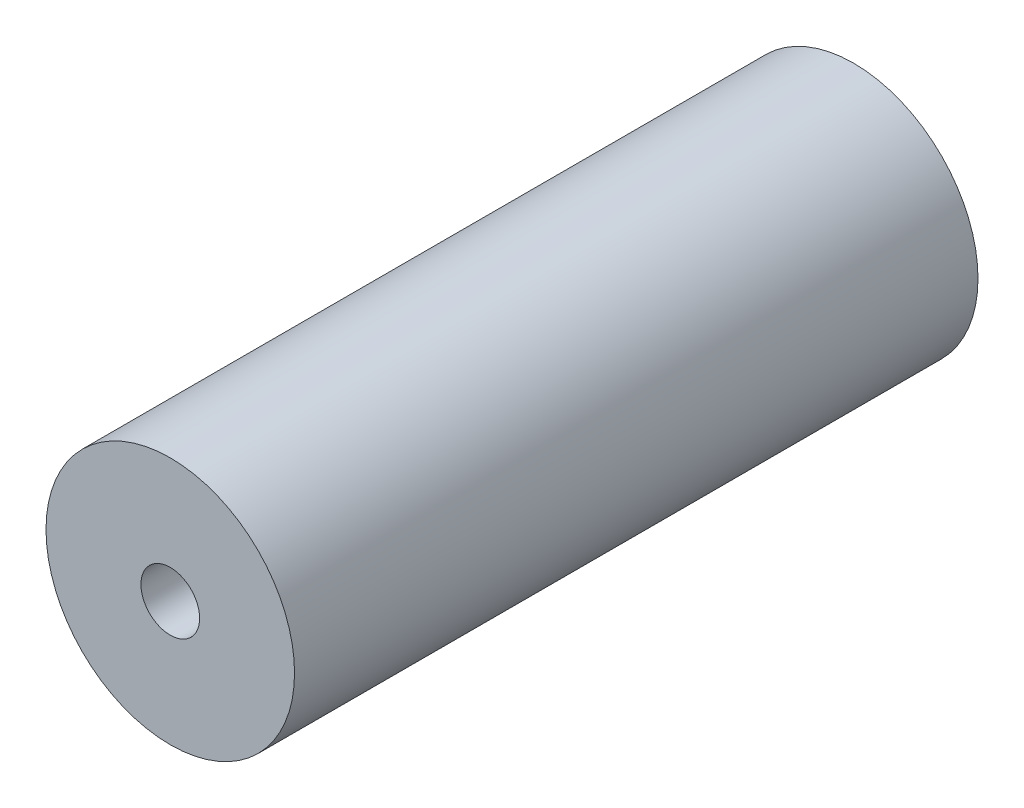
from build123d import *

# Parameters (mm, degrees)
SKETCH1_R           = 12.7
BOSS_EXTRUDE1_DEPTH = 69.85
SKETCH2_R           = 3
CUT_EXTRUDE3_DEPTH  = 69.85


with BuildPart() as part:
    # Sketch1 → Boss-Extrude1 (new body)
    with BuildSketch(Plane.XY):
        Circle(SKETCH1_R)
    extrude(amount=BOSS_EXTRUDE1_DEPTH)

    # Sketch2 → Cut-Extrude3 (cut)
    with BuildSketch(Plane.XY.offset(69.85)):
        Circle(SKETCH2_R)
    extrude(amount=-CUT_EXTRUDE3_DEPTH, mode=Mode.SUBTRACT)


solid = part.part
